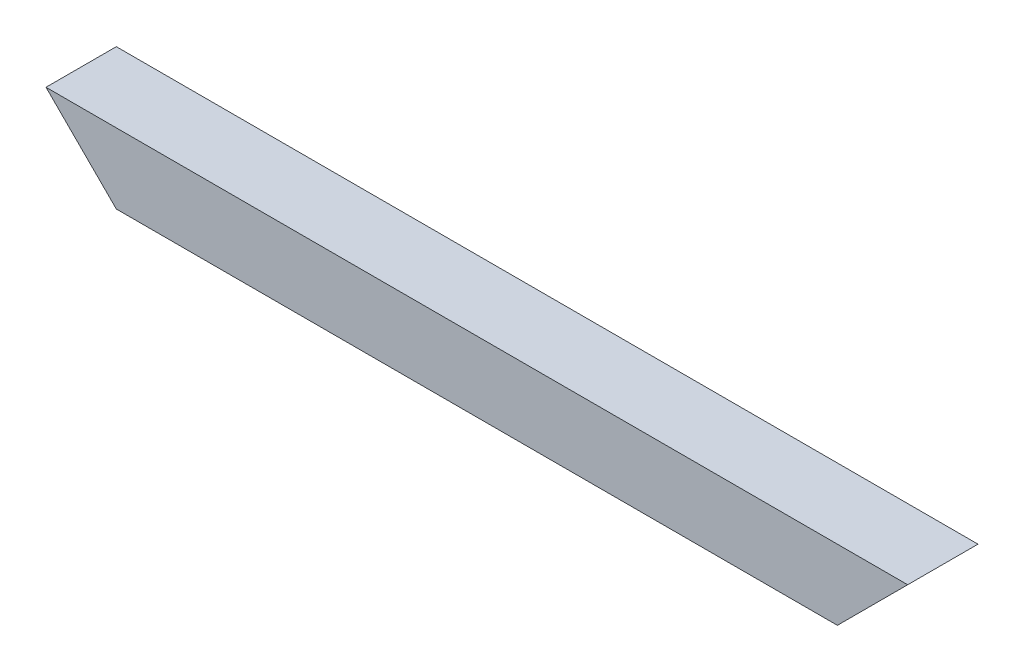
from build123d import *

# Parameters (mm, degrees)
SKETCH1_W               = 38.1
SKETCH1_H               = 38.1
BOSS_EXTRUDE1_DEPTH     = 466.973318299
CUT_EXTRUDE1_DEPTH      = 471.071590296
CUT_EXTRUDE1_DEPTH_BACK = 471.071590296
CUT_EXTRUDE2_DEPTH      = 471.071590296
CUT_EXTRUDE2_DEPTH_BACK = 471.071590296


with BuildPart() as part:
    # Sketch1 → Boss-Extrude1 (new body)
    with BuildSketch(Plane(origin=(0, 0, 0), x_dir=(0, 0, -1), z_dir=(1, 0, 0))):
        with Locations((19.05, -19.05)):
            Rectangle(SKETCH1_W, SKETCH1_H)
    extrude(amount=BOSS_EXTRUDE1_DEPTH)

    # Sketch2 → Cut-Extrude1 (cut, two sides: drawn at the far end of the back side and taken through both)
    with BuildSketch(Plane.XY.offset(-CUT_EXTRUDE1_DEPTH_BACK)):
        Polygon((-947.050030689, -38.1), (0, -38.1), (38.1, -38.1), (0, 0), (-669.665498823, 669.665498823), (-2433.166300963, 1360.809451531), (-2710.550832829, 653.043952708), align=None)
    extrude(amount=CUT_EXTRUDE1_DEPTH + CUT_EXTRUDE1_DEPTH_BACK, mode=Mode.SUBTRACT)

    # Sketch3 → Cut-Extrude2 (cut, two sides: drawn at the far end of the back side and taken through both)
    with BuildSketch(Plane.XY.offset(-CUT_EXTRUDE2_DEPTH_BACK)):
        Polygon((1414.023348988, -38.1), (466.973318299, -38.1), (428.873318299, -38.1), (466.973318299, 0), (1136.638817123, 669.665498823), (2900.139619262, 1360.809451531), (3177.524151128, 653.043952708), align=None)
    extrude(amount=CUT_EXTRUDE2_DEPTH + CUT_EXTRUDE2_DEPTH_BACK, mode=Mode.SUBTRACT)


solid = part.part
